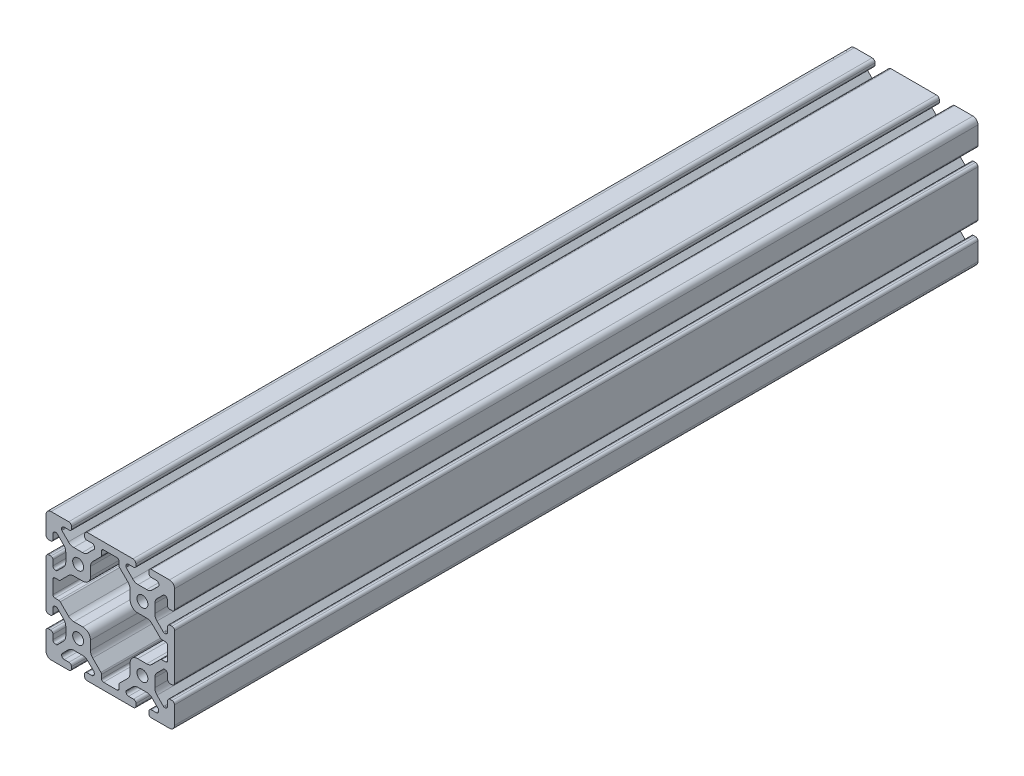
from build123d import *

# Parameters (mm, degrees)
SKETCH1_R      = 3.4
EXTRUDE1_DEPTH = 500


with BuildPart() as part:
    # Sketch1 → Extrude1 (new body)
    with BuildSketch(Plane.XY):
        with BuildLine():
            Line((29.091242789, 26.036541495), (33.082657296, 30.027956002))
            ThreePointArc((33.082657296, 30.027956002), (33.329219041, 30.192703293), (33.62005845, 30.250554848))
            Line((33.62005845, 30.250554848), (33.955571436, 30.250554848))
            ThreePointArc((33.955571436, 30.250554848), (35.065729082, 29.790712494), (35.525571436, 28.680554848))
            Line((35.525571436, 28.680554848), (35.525571436, 25.777866899))
            ThreePointArc((35.525571436, 25.777866899), (35.985413789, 24.667709253), (37.095571436, 24.207866899))
            Line((37.095571436, 24.207866899), (38.43, 24.207866899))
            ThreePointArc((38.43, 24.207866899), (39.540157646, 24.667709253), (40, 25.777866899))
            Line((40, 25.777866899), (40, 32.933852749))
            Line((40, 32.933852749), (40, 36.83))
            ThreePointArc((40, 36.83), (39.071528496, 39.071528496), (36.83, 40))
            Line((36.83, 40), (25.540851266, 40))
            ThreePointArc((25.540851266, 40), (24.43069362, 39.540157646), (23.970851266, 38.43))
            Line((23.970851266, 38.43), (23.970851266, 37.249043598))
            ThreePointArc((23.970851266, 37.249043598), (24.43069362, 36.138885952), (25.540851266, 35.679043598))
            Line((25.540851266, 35.679043598), (28.625762638, 35.679043598))
            ThreePointArc((28.625762638, 35.679043598), (29.77116849, 35.239363487), (30.250554848, 34.11))
            Line((30.250554848, 34.11), (30.250554848, 33.62005845))
            ThreePointArc((30.250554848, 33.62005845), (30.192703293, 33.329219041), (30.027956002, 33.082657296))
            Line((30.027956002, 33.082657296), (26.036541495, 29.091242789))
            ThreePointArc((26.036541495, 29.091242789), (24.495530588, 28.061572221), (22.677784284, 27.7))
            Line((22.677784284, 27.7), (17.322215716, 27.7))
            ThreePointArc((17.322215716, 27.7), (15.504469412, 28.061572221), (13.963458505, 29.091242789))
            Line((13.963458505, 29.091242789), (9.90393336, 33.150767934))
            ThreePointArc((9.90393336, 33.150767934), (9.764102181, 33.360040084), (9.715, 33.606893415))
            Line((9.715, 33.606893415), (9.715, 34.096834965))
            ThreePointArc((9.715, 34.096834965), (10.178698303, 35.216301697), (11.298165035, 35.68))
            Line((11.298165035, 35.68), (14.642754087, 35.68))
            ThreePointArc((14.642754087, 35.68), (15.560045469, 36.059954531), (15.94, 36.977245913))
            Line((15.94, 36.977245913), (15.94, 38.194841282))
            ThreePointArc((15.94, 38.194841282), (15.411281253, 39.471281253), (14.134841282, 40))
            Line((14.134841282, 40), (6.984433948, 40))
            Line((6.984433948, 40), (-6.984433948, 40))
            Line((-6.984433948, 40), (-14.134841282, 40))
            ThreePointArc((-14.134841282, 40), (-15.411281253, 39.471281253), (-15.94, 38.194841282))
            Line((-15.94, 38.194841282), (-15.94, 36.977245913))
            ThreePointArc((-15.94, 36.977245913), (-15.560045469, 36.059954531), (-14.642754087, 35.68))
            Line((-14.642754087, 35.68), (-11.298165035, 35.68))
            ThreePointArc((-11.298165035, 35.68), (-10.178698303, 35.216301697), (-9.715, 34.096834965))
            Line((-9.715, 34.096834965), (-9.715, 33.606893415))
            ThreePointArc((-9.715, 33.606893415), (-9.764102181, 33.360040084), (-9.90393336, 33.150767934))
            Line((-9.90393336, 33.150767934), (-13.963458505, 29.091242789))
            ThreePointArc((-13.963458505, 29.091242789), (-15.504469412, 28.061572221), (-17.322215716, 27.7))
            Line((-17.322215716, 27.7), (-22.677784284, 27.7))
            ThreePointArc((-22.677784284, 27.7), (-24.495530588, 28.061572221), (-26.036541495, 29.091242789))
            Line((-26.036541495, 29.091242789), (-30.09606664, 33.150767934))
            ThreePointArc((-30.09606664, 33.150767934), (-30.235897819, 33.360040084), (-30.285, 33.606893415))
            Line((-30.285, 33.606893415), (-30.285, 34.096834965))
            ThreePointArc((-30.285, 34.096834965), (-29.821301697, 35.216301697), (-28.701834965, 35.68))
            Line((-28.701834965, 35.68), (-25.357245913, 35.68))
            ThreePointArc((-25.357245913, 35.68), (-24.439954531, 36.059954531), (-24.06, 36.977245913))
            Line((-24.06, 36.977245913), (-24.06, 38.194841282))
            ThreePointArc((-24.06, 38.194841282), (-24.588718747, 39.471281253), (-25.865158718, 40))
            Line((-25.865158718, 40), (-33.031395847, 40))
            Line((-33.031395847, 40), (-36.83, 40))
            ThreePointArc((-36.83, 40), (-39.071528496, 39.071528496), (-40, 36.83))
            Line((-40, 36.83), (-40, 33.318079463))
            Line((-40, 33.318079463), (-40, 25.865158718))
            ThreePointArc((-40, 25.865158718), (-39.471281253, 24.588718747), (-38.194841282, 24.06))
            Line((-38.194841282, 24.06), (-36.977245913, 24.06))
            ThreePointArc((-36.977245913, 24.06), (-36.059954531, 24.439954531), (-35.68, 25.357245913))
            Line((-35.68, 25.357245913), (-35.68, 28.680554848))
            ThreePointArc((-35.68, 28.680554848), (-35.220157646, 29.790712494), (-34.11, 30.250554848))
            Line((-34.11, 30.250554848), (-33.62005845, 30.250554848))
            ThreePointArc((-33.62005845, 30.250554848), (-33.329219041, 30.192703293), (-33.082657296, 30.027956002))
            Line((-33.082657296, 30.027956002), (-29.091242789, 26.036541495))
            ThreePointArc((-29.091242789, 26.036541495), (-28.061572221, 24.495530588), (-27.7, 22.677784284))
            Line((-27.7, 22.677784284), (-27.7, 17.322215716))
            ThreePointArc((-27.7, 17.322215716), (-28.061572221, 15.504469412), (-29.091242789, 13.963458505))
            Line((-29.091242789, 13.963458505), (-33.082657296, 9.972043998))
            ThreePointArc((-33.082657296, 9.972043998), (-33.329219041, 9.807296707), (-33.62005845, 9.749445152))
            Line((-33.62005845, 9.749445152), (-34.11, 9.749445152))
            ThreePointArc((-34.11, 9.749445152), (-35.220157646, 10.209287506), (-35.68, 11.319445152))
            Line((-35.68, 11.319445152), (-35.68, 14.642754087))
            ThreePointArc((-35.68, 14.642754087), (-36.059954531, 15.560045469), (-36.977245913, 15.94))
            Line((-36.977245913, 15.94), (-38.194841282, 15.94))
            ThreePointArc((-38.194841282, 15.94), (-39.471281253, 15.411281253), (-40, 14.134841282))
            Line((-40, 14.134841282), (-40, 7.016888977))
            Line((-40, 7.016888977), (-40, -7.016888977))
            Line((-40, -7.016888977), (-40, -14.447338303))
            ThreePointArc((-40, -14.447338303), (-39.540157646, -15.557495949), (-38.43, -16.017338303))
            Line((-38.43, -16.017338303), (-37.25, -16.017338303))
            ThreePointArc((-37.25, -16.017338303), (-36.139842354, -15.557495949), (-35.68, -14.447338303))
            Line((-35.68, -14.447338303), (-35.68, -11.319445152))
            ThreePointArc((-35.68, -11.319445152), (-35.220157646, -10.209287506), (-34.11, -9.749445152))
            Line((-34.11, -9.749445152), (-33.62005845, -9.749445152))
            ThreePointArc((-33.62005845, -9.749445152), (-33.329219041, -9.807296707), (-33.082657296, -9.972043998))
            Line((-33.082657296, -9.972043998), (-29.091242789, -13.963458505))
            ThreePointArc((-29.091242789, -13.963458505), (-28.061572221, -15.504469412), (-27.7, -17.322215716))
            Line((-27.7, -17.322215716), (-27.7, -22.677784284))
            ThreePointArc((-27.7, -22.677784284), (-28.061572221, -24.495530588), (-29.091242789, -26.036541495))
            Line((-29.091242789, -26.036541495), (-32.871776968, -29.817075674))
            ThreePointArc((-32.871776968, -29.817075674), (-33.10612883, -29.976640176), (-33.382654504, -30.039211548))
            Line((-33.382654504, -30.039211548), (-34.05520779, -30.062697627))
            ThreePointArc((-34.05520779, -30.062697627), (-35.200613642, -29.623017515), (-35.68, -28.493654028))
            Line((-35.68, -28.493654028), (-35.68, -25.59096608))
            ThreePointArc((-35.68, -25.59096608), (-36.139842354, -24.480808433), (-37.25, -24.02096608))
            Line((-37.25, -24.02096608), (-38.43, -24.02096608))
            ThreePointArc((-38.43, -24.02096608), (-39.540157646, -24.480808433), (-40, -25.59096608))
            Line((-40, -25.59096608), (-40, -33.019082273))
            Line((-40, -33.019082273), (-40, -36.83))
            ThreePointArc((-40, -36.83), (-39.071528496, -39.071528496), (-36.83, -40))
            Line((-36.83, -40), (-33, -40))
            Line((-33, -40), (-25.72307469, -40))
            ThreePointArc((-25.72307469, -40), (-24.612917043, -39.540157646), (-24.15307469, -38.43))
            Line((-24.15307469, -38.43), (-24.15307469, -37.25))
            ThreePointArc((-24.15307469, -37.25), (-24.612917043, -36.139842354), (-25.72307469, -35.68))
            Line((-25.72307469, -35.68), (-28.680554848, -35.68))
            ThreePointArc((-28.680554848, -35.68), (-29.790712494, -35.220157646), (-30.250554848, -34.11))
            Line((-30.250554848, -34.11), (-30.250554848, -33.62005845))
            ThreePointArc((-30.250554848, -33.62005845), (-30.192703293, -33.329219041), (-30.027956002, -33.082657296))
            Line((-30.027956002, -33.082657296), (-26.036541495, -29.091242789))
            ThreePointArc((-26.036541495, -29.091242789), (-24.495530588, -28.061572221), (-22.677784284, -27.7))
            Line((-22.677784284, -27.7), (-17.322215716, -27.7))
            ThreePointArc((-17.322215716, -27.7), (-15.504469412, -28.061572221), (-13.963458505, -29.091242789))
            Line((-13.963458505, -29.091242789), (-10.203784275, -32.85091702))
            ThreePointArc((-10.203784275, -32.85091702), (-10.044219772, -33.085268882), (-9.9816484, -33.361794556))
            Line((-9.9816484, -33.361794556), (-9.957433876, -34.05520779))
            ThreePointArc((-9.957433876, -34.05520779), (-10.397113988, -35.200613642), (-11.526477474, -35.68))
            Line((-11.526477474, -35.68), (-14.429165423, -35.68))
            ThreePointArc((-14.429165423, -35.68), (-15.539323069, -36.139842354), (-15.999165423, -37.25))
            Line((-15.999165423, -37.25), (-15.999165423, -38.43))
            ThreePointArc((-15.999165423, -38.43), (-15.539323069, -39.540157646), (-14.429165423, -40))
            Line((-14.429165423, -40), (-6.998716097, -40))
            Line((-6.998716097, -40), (6.998716097, -40))
            Line((6.998716097, -40), (14.424638994, -40))
            ThreePointArc((14.424638994, -40), (15.53479664, -39.540157646), (15.994638994, -38.43))
            Line((15.994638994, -38.43), (15.994638994, -37.032644306))
            ThreePointArc((15.994638994, -37.032644306), (15.53479664, -35.922486659), (14.424638994, -35.462644306))
            Line((14.424638994, -35.462644306), (11.382372282, -35.462644306))
            ThreePointArc((11.382372282, -35.462644306), (10.272214636, -35.002801952), (9.812372282, -33.892644306))
            Line((9.812372282, -33.892644306), (9.812372282, -33.55713132))
            ThreePointArc((9.812372282, -33.55713132), (9.870223837, -33.266291912), (10.034971128, -33.019730166))
            Line((10.034971128, -33.019730166), (13.963458505, -29.091242789))
            ThreePointArc((13.963458505, -29.091242789), (15.504469412, -28.061572221), (17.322215716, -27.7))
            Line((17.322215716, -27.7), (22.677784284, -27.7))
            ThreePointArc((22.677784284, -27.7), (24.495530588, -28.061572221), (26.036541495, -29.091242789))
            Line((26.036541495, -29.091242789), (29.794925243, -32.849626538))
            ThreePointArc((29.794925243, -32.849626538), (29.954489746, -33.083978399), (30.017061118, -33.360504074))
            Line((30.017061118, -33.360504074), (30.041320706, -34.05520779))
            ThreePointArc((30.041320706, -34.05520779), (29.601640594, -35.200613642), (28.472277108, -35.68))
            Line((28.472277108, -35.68), (25.569589159, -35.68))
            ThreePointArc((25.569589159, -35.68), (24.459431513, -36.139842354), (23.999589159, -37.25))
            Line((23.999589159, -37.25), (23.999589159, -38.43))
            ThreePointArc((23.999589159, -38.43), (24.459431513, -39.540157646), (25.569589159, -40))
            Line((25.569589159, -40), (32.999849358, -40))
            Line((32.999849358, -40), (36.83, -40))
            ThreePointArc((36.83, -40), (39.071528496, -39.071528496), (40, -36.83))
            Line((40, -36.83), (40, -33.025941835))
            Line((40, -33.025941835), (40, -25.777866899))
            ThreePointArc((40, -25.777866899), (39.540157646, -24.667709253), (38.43, -24.207866899))
            Line((38.43, -24.207866899), (37.25, -24.207866899))
            ThreePointArc((37.25, -24.207866899), (36.139842354, -24.667709253), (35.68, -25.777866899))
            Line((35.68, -25.777866899), (35.68, -28.680554848))
            ThreePointArc((35.68, -28.680554848), (35.220157646, -29.790712494), (34.11, -30.250554848))
            Line((34.11, -30.250554848), (33.62005845, -30.250554848))
            ThreePointArc((33.62005845, -30.250554848), (33.329219041, -30.192703293), (33.082657296, -30.027956002))
            Line((33.082657296, -30.027956002), (29.091242789, -26.036541495))
            ThreePointArc((29.091242789, -26.036541495), (28.061572221, -24.495530588), (27.7, -22.677784284))
            Line((27.7, -22.677784284), (27.7, -17.322215716))
            ThreePointArc((27.7, -17.322215716), (28.061572221, -15.504469412), (29.091242789, -13.963458505))
            Line((29.091242789, -13.963458505), (33.082657296, -9.972043998))
            ThreePointArc((33.082657296, -9.972043998), (33.329219041, -9.807296707), (33.62005845, -9.749445152))
            Line((33.62005845, -9.749445152), (34.11, -9.749445152))
            ThreePointArc((34.11, -9.749445152), (35.220157646, -10.209287506), (35.68, -11.319445152))
            Line((35.68, -11.319445152), (35.68, -14.222133101))
            ThreePointArc((35.68, -14.222133101), (36.139842354, -15.332290747), (37.25, -15.792133101))
            Line((37.25, -15.792133101), (38.43, -15.792133101))
            ThreePointArc((38.43, -15.792133101), (39.540157646, -15.332290747), (40, -14.222133101))
            Line((40, -14.222133101), (40, -7.021415406))
            Line((40, -7.021415406), (40, 7.021415406))
            Line((40, 7.021415406), (40, 14.222133101))
            ThreePointArc((40, 14.222133101), (39.540157646, 15.332290747), (38.43, 15.792133101))
            Line((38.43, 15.792133101), (37.25, 15.792133101))
            ThreePointArc((37.25, 15.792133101), (36.139842354, 15.332290747), (35.68, 14.222133101))
            Line((35.68, 14.222133101), (35.68, 11.319445152))
            ThreePointArc((35.68, 11.319445152), (35.220157646, 10.209287506), (34.11, 9.749445152))
            Line((34.11, 9.749445152), (33.62005845, 9.749445152))
            ThreePointArc((33.62005845, 9.749445152), (33.329219041, 9.807296707), (33.082657296, 9.972043998))
            Line((33.082657296, 9.972043998), (29.091242789, 13.963458505))
            ThreePointArc((29.091242789, 13.963458505), (28.061572221, 15.504469412), (27.7, 17.322215716))
            Line((27.7, 17.322215716), (27.7, 22.677784284))
            ThreePointArc((27.7, 22.677784284), (28.061572221, 24.495530588), (29.091242789, 26.036541495))
        make_face()
        with Locations((-20, 20)):
            Circle(SKETCH1_R, mode=Mode.SUBTRACT)
        with Locations((20, 20)):
            Circle(SKETCH1_R, mode=Mode.SUBTRACT)
        with Locations((20, -20)):
            Circle(SKETCH1_R, mode=Mode.SUBTRACT)
        with Locations((-20, -20)):
            Circle(SKETCH1_R, mode=Mode.SUBTRACT)
        with BuildLine():
            Line((17.07, 12.32), (22.657784284, 12.32))
            ThreePointArc((22.657784284, 12.32), (24.475530588, 11.958427779), (26.016541495, 10.928757211))
            Line((26.016541495, 10.928757211), (31.143879165, 5.80141954))
            ThreePointArc((31.143879165, 5.80141954), (31.555896818, 5.526118146), (32.041904777, 5.429445152))
            Line((32.041904777, 5.429445152), (34.41, 5.429445152))
            ThreePointArc((34.41, 5.429445152), (35.308025612, 5.057470764), (35.68, 4.159445152))
            Line((35.68, 4.159445152), (35.68, -4.159445152))
            ThreePointArc((35.68, -4.159445152), (35.308025612, -5.057470764), (34.41, -5.429445152))
            Line((34.41, -5.429445152), (32.041904777, -5.429445152))
            ThreePointArc((32.041904777, -5.429445152), (31.555896818, -5.526118146), (31.143879165, -5.80141954))
            Line((31.143879165, -5.80141954), (26.016541495, -10.928757211))
            ThreePointArc((26.016541495, -10.928757211), (24.475530588, -11.958427779), (22.657784284, -12.32))
            Line((22.657784284, -12.32), (17.07, -12.32))
            ThreePointArc((17.07, -12.32), (13.711242789, -13.711242789), (12.32, -17.07))
            Line((12.32, -17.07), (12.32, -22.657784284))
            ThreePointArc((12.32, -22.657784284), (11.958427779, -24.475530588), (10.928757211, -26.016541495))
            Line((10.928757211, -26.016541495), (5.80141954, -31.143879165))
            ThreePointArc((5.80141954, -31.143879165), (5.526118146, -31.555896818), (5.429445152, -32.041904777))
            Line((5.429445152, -32.041904777), (5.429445152, -34.41))
            ThreePointArc((5.429445152, -34.41), (5.057470764, -35.308025612), (4.159445152, -35.68))
            Line((4.159445152, -35.68), (-4.159445152, -35.68))
            ThreePointArc((-4.159445152, -35.68), (-5.057470764, -35.308025612), (-5.429445152, -34.41))
            Line((-5.429445152, -34.41), (-5.429445152, -32.041904777))
            ThreePointArc((-5.429445152, -32.041904777), (-5.526118146, -31.555896818), (-5.80141954, -31.143879165))
            Line((-5.80141954, -31.143879165), (-10.928757211, -26.016541495))
            ThreePointArc((-10.928757211, -26.016541495), (-11.958427779, -24.475530588), (-12.32, -22.657784284))
            Line((-12.32, -22.657784284), (-12.32, -17.07))
            ThreePointArc((-12.32, -17.07), (-13.711242789, -13.711242789), (-17.07, -12.32))
            Line((-17.07, -12.32), (-22.657784284, -12.32))
            ThreePointArc((-22.657784284, -12.32), (-24.475530588, -11.958427779), (-26.016541495, -10.928757211))
            Line((-26.016541495, -10.928757211), (-31.143879165, -5.80141954))
            ThreePointArc((-31.143879165, -5.80141954), (-31.555896818, -5.526118146), (-32.041904777, -5.429445152))
            Line((-32.041904777, -5.429445152), (-34.41, -5.429445152))
            ThreePointArc((-34.41, -5.429445152), (-35.308025612, -5.057470764), (-35.68, -4.159445152))
            Line((-35.68, -4.159445152), (-35.68, 4.159445152))
            ThreePointArc((-35.68, 4.159445152), (-35.308025612, 5.057470764), (-34.41, 5.429445152))
            Line((-34.41, 5.429445152), (-32.041904777, 5.429445152))
            ThreePointArc((-32.041904777, 5.429445152), (-31.555896818, 5.526118146), (-31.143879165, 5.80141954))
            Line((-31.143879165, 5.80141954), (-26.016541495, 10.928757211))
            ThreePointArc((-26.016541495, 10.928757211), (-24.475530588, 11.958427779), (-22.657784284, 12.32))
            Line((-22.657784284, 12.32), (-17.07, 12.32))
            ThreePointArc((-17.07, 12.32), (-13.711242789, 13.711242789), (-12.32, 17.07))
            Line((-12.32, 17.07), (-12.32, 22.657784284))
            ThreePointArc((-12.32, 22.657784284), (-11.958427779, 24.475530588), (-10.928757211, 26.016541495))
            Line((-10.928757211, 26.016541495), (-5.80141954, 31.143879165))
            ThreePointArc((-5.80141954, 31.143879165), (-5.526118146, 31.555896818), (-5.429445152, 32.041904777))
            Line((-5.429445152, 32.041904777), (-5.429445152, 34.41))
            ThreePointArc((-5.429445152, 34.41), (-5.057470764, 35.308025612), (-4.159445152, 35.68))
            Line((-4.159445152, 35.68), (4.159445152, 35.68))
            ThreePointArc((4.159445152, 35.68), (5.057470764, 35.308025612), (5.429445152, 34.41))
            Line((5.429445152, 34.41), (5.429445152, 32.041904777))
            ThreePointArc((5.429445152, 32.041904777), (5.526118146, 31.555896818), (5.80141954, 31.143879165))
            Line((5.80141954, 31.143879165), (10.928757211, 26.016541495))
            ThreePointArc((10.928757211, 26.016541495), (11.958427779, 24.475530588), (12.32, 22.657784284))
            Line((12.32, 22.657784284), (12.32, 17.07))
            ThreePointArc((12.32, 17.07), (13.711242789, 13.711242789), (17.07, 12.32))
        make_face(mode=Mode.SUBTRACT)
    extrude(amount=-EXTRUDE1_DEPTH)


solid = part.part
